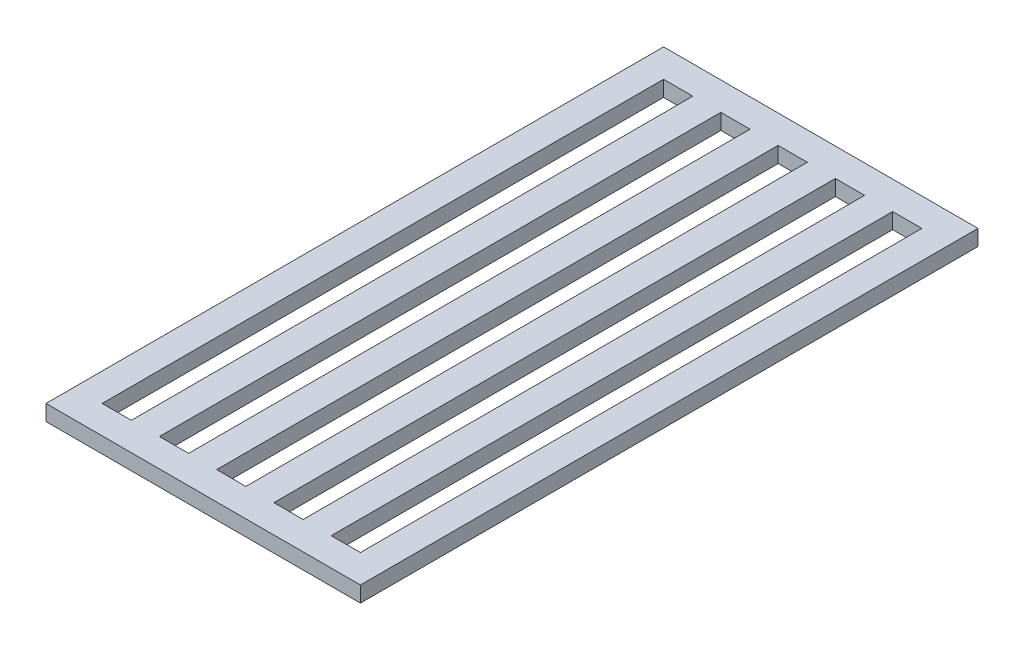
from build123d import *

# Parameters (mm, degrees)
SKETCH1_W           = 56
SKETCH1_H           = 110
SKETCH1_W_2         = 5.2
SKETCH1_H_2         = 100
BOSS_EXTRUDE1_DEPTH = 2.8


with BuildPart() as part:
    # Sketch1 → Boss-Extrude1 (new body)
    with BuildSketch(Plane(origin=(0, 0, 0), x_dir=(1, 0, 0), z_dir=(0, 1, 0))):
        with Locations((28, 55)):
            Rectangle(SKETCH1_W, SKETCH1_H)
        with Locations((17.8, 55)):
            Rectangle(SKETCH1_W_2, SKETCH1_H_2, mode=Mode.SUBTRACT)
        with Locations((7.6, 55)):
            Rectangle(SKETCH1_W_2, SKETCH1_H_2, mode=Mode.SUBTRACT)
        with Locations((28, 55)):
            Rectangle(SKETCH1_W_2, SKETCH1_H_2, mode=Mode.SUBTRACT)
        with Locations((38.2, 55)):
            Rectangle(SKETCH1_W_2, SKETCH1_H_2, mode=Mode.SUBTRACT)
        with Locations((48.4, 55)):
            Rectangle(SKETCH1_W_2, SKETCH1_H_2, mode=Mode.SUBTRACT)
    extrude(amount=BOSS_EXTRUDE1_DEPTH)


solid = part.part
